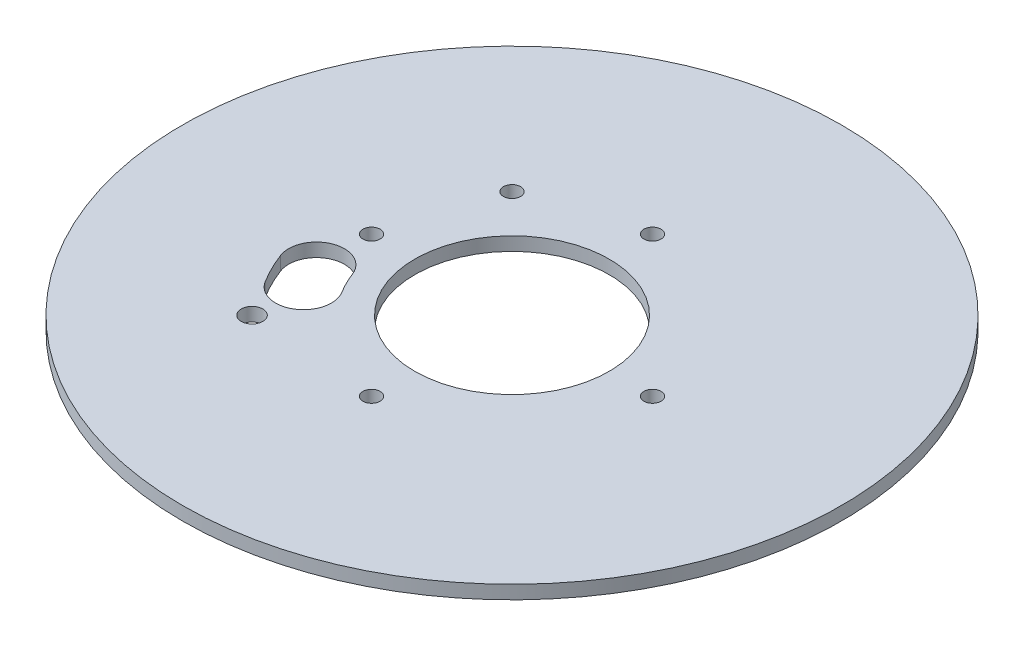
from build123d import *

# Parameters (mm, degrees)
SKETCH1_R           = 77.4600051
BOSS_EXTRUDE1_DEPTH = 3.175
SKETCH20_R          = 22.86
SKETCH20_R_2        = 2.0193
CUT_EXTRUDE10_DEPTH = 251.865681086
SKETCH21_R          = 2.0193
CUT_EXTRUDE11_DEPTH = 251.865681086
CUT_EXTRUDE12_DEPTH = 251.865681086
SKETCH23_R          = 2.54
CUT_EXTRUDE13_DEPTH = 3.175


with BuildPart() as part:
    # Sketch1 → Boss-Extrude1 (new body)
    with BuildSketch(Plane(origin=(0, 0, 0), x_dir=(1, 0, 0), z_dir=(0, 1, 0))):
        with Locations(Location((0, 0, 0), (0, 0, 270))):
            Circle(SKETCH1_R)
    extrude(amount=BOSS_EXTRUDE1_DEPTH)

    # Sketch20 → Cut-Extrude10 (cut, through all)
    with BuildSketch(Plane(origin=(-73.768816189, 25.4, -121.080352405), x_dir=(1, 0, 0), z_dir=(0, 1, 0))):
        with Locations(Location((73.768816189, -121.080352405, 0), (0, 0, 270))):
            Circle(SKETCH20_R)
        with Locations(Location((73.768816189, -88.060352405, 0), (0, 0, 270))):
            Circle(SKETCH20_R_2)
        with Locations(Location((106.788816189, -121.080352405, 0), (0, 0, 270))):
            Circle(SKETCH20_R_2)
        with Locations(Location((73.768816189, -154.100352405, 0), (0, 0, 270))):
            Circle(SKETCH20_R_2)
        with Locations(Location((40.748816189, -121.080352405, 0), (0, 0, 270))):
            Circle(SKETCH20_R_2)
    extrude(amount=-CUT_EXTRUDE10_DEPTH, mode=Mode.SUBTRACT)

    # Sketch21 → Cut-Extrude11 (cut, through all)
    with BuildSketch(Plane(origin=(-73.768816189, 25.4, -121.080352405), x_dir=(1, 0, 0), z_dir=(0, 1, 0))):
        with Locations(Location((48.605023435, -95.916559651, 0), (0, 0, 270))):
            Circle(SKETCH21_R)
    extrude(amount=-CUT_EXTRUDE11_DEPTH, mode=Mode.SUBTRACT)

    # Sketch22 → Cut-Extrude12 (cut, through all)
    with BuildSketch(Plane(origin=(-73.768816189, 25.4, -121.080352405), x_dir=(1, 0, 0), z_dir=(0, 1, 0))):
        with BuildLine():
            ThreePointArc((34.405967979, -136.122213123), (36.00963526, -139.786919397), (37.953573181, -143.283049568))
            ThreePointArc((37.953573181, -143.283049568), (46.974494303, -145.399596657), (49.091041391, -136.378675534))
            ThreePointArc((49.091041391, -136.378675534), (47.751609959, -133.969737166), (46.646635186, -131.444644817))
            ThreePointArc((46.646635186, -131.444644817), (38.18751743, -127.663095366), (34.405967979, -136.122213123))
        make_face()
    extrude(amount=-CUT_EXTRUDE12_DEPTH, mode=Mode.SUBTRACT)

    # Sketch23 → Cut-Extrude13 (cut)
    with BuildSketch(Plane(origin=(-73.768816189, 0, -121.080352405), x_dir=(1, 0, 0), z_dir=(0, -1, 0))):
        with Locations(Location((43.216869762, 151.632298832, 0), (0, 0, 270))):
            Circle(SKETCH23_R)
    extrude(amount=-CUT_EXTRUDE13_DEPTH, mode=Mode.SUBTRACT)


solid = part.part
